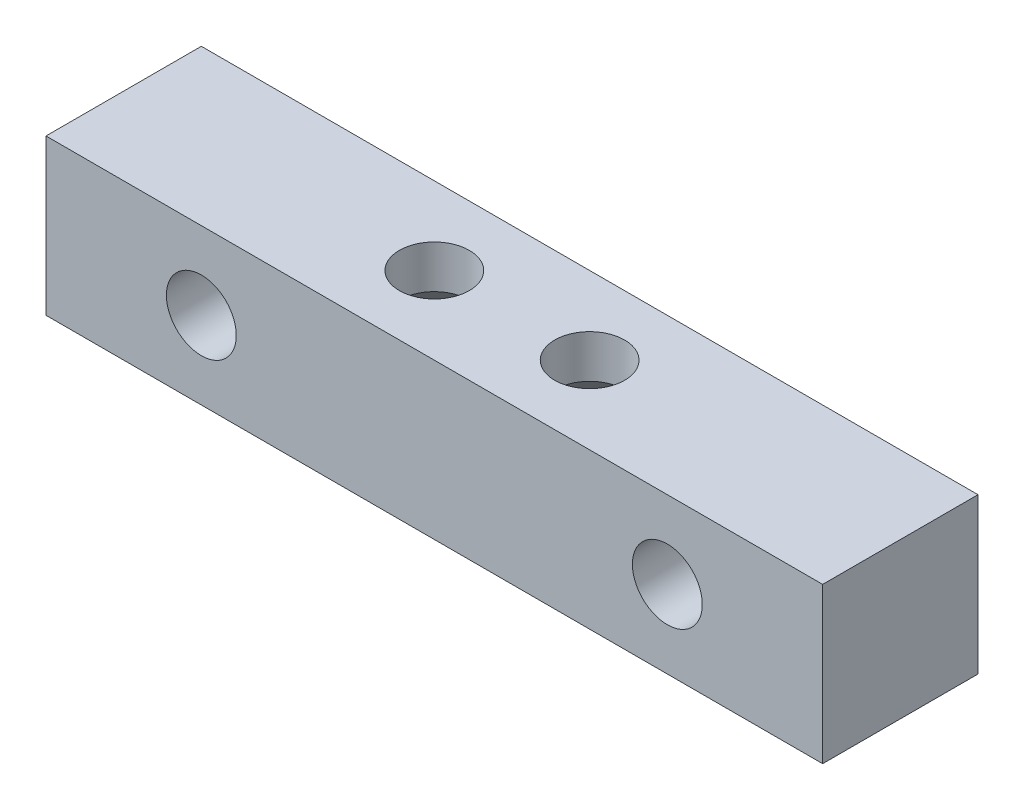
from build123d import *

# Parameters (mm, degrees)
SKETCH1_W                               = 50
SKETCH1_H                               = 10
BOSS_EXTRUDE1_DEPTH                     = 10
CSK_FOR_M4_SFHCS1_AT_2_COUNT            = 2
CSK_FOR_M4_SFHCS1_AT_2_PITCH            = 10
CBORE_FOR_M5_HEX_HEAD_BOLT1_D           = 4.5
CBORE_FOR_M5_HEX_HEAD_BOLT1_CBORE_D     = 5
CBORE_FOR_M5_HEX_HEAD_BOLT1_CBORE_DEPTH = 4.2


with BuildPart() as part:
    # Sketch1 → Boss-Extrude1 (new body)
    with BuildSketch(Plane.XY):
        Rectangle(SKETCH1_W, SKETCH1_H)
    extrude(amount=BOSS_EXTRUDE1_DEPTH)

    # Sketch9 → CSK for M4 SFHCS1 (revolve, cut)
    with BuildSketch(Plane(origin=(5, -5, 5), x_dir=(0, 0, -1), z_dir=(1, 0, 0))):
        Polygon((0, 0), (0, 10), (2.25, 10), (2.25, 7.23), (4.48, 5), (4.48, 0), align=None)
    csk_for_m4_sfhcs1 = revolve(axis=Axis((5, -11.35, 5), (0, 1, 0)), mode=Mode.SUBTRACT)

    # CSK for M4 SFHCS1 at 2: CSK for M4 SFHCS1 ×2
    with Locations(*[(-i * CSK_FOR_M4_SFHCS1_AT_2_PITCH, 0, 0) for i in range(1, CSK_FOR_M4_SFHCS1_AT_2_COUNT)]):
        add(csk_for_m4_sfhcs1, mode=Mode.SUBTRACT)

    # CBORE for M5 Hex Head Bolt1 (through all)
    with Locations(Plane(origin=(0, 0, 0), x_dir=(-1, 0, 0), z_dir=(0, 0, -1))):
        with Locations((-15, 0), (15, 0)):
            CounterBoreHole(CBORE_FOR_M5_HEX_HEAD_BOLT1_D / 2, CBORE_FOR_M5_HEX_HEAD_BOLT1_CBORE_D / 2, CBORE_FOR_M5_HEX_HEAD_BOLT1_CBORE_DEPTH)


solid = part.part
